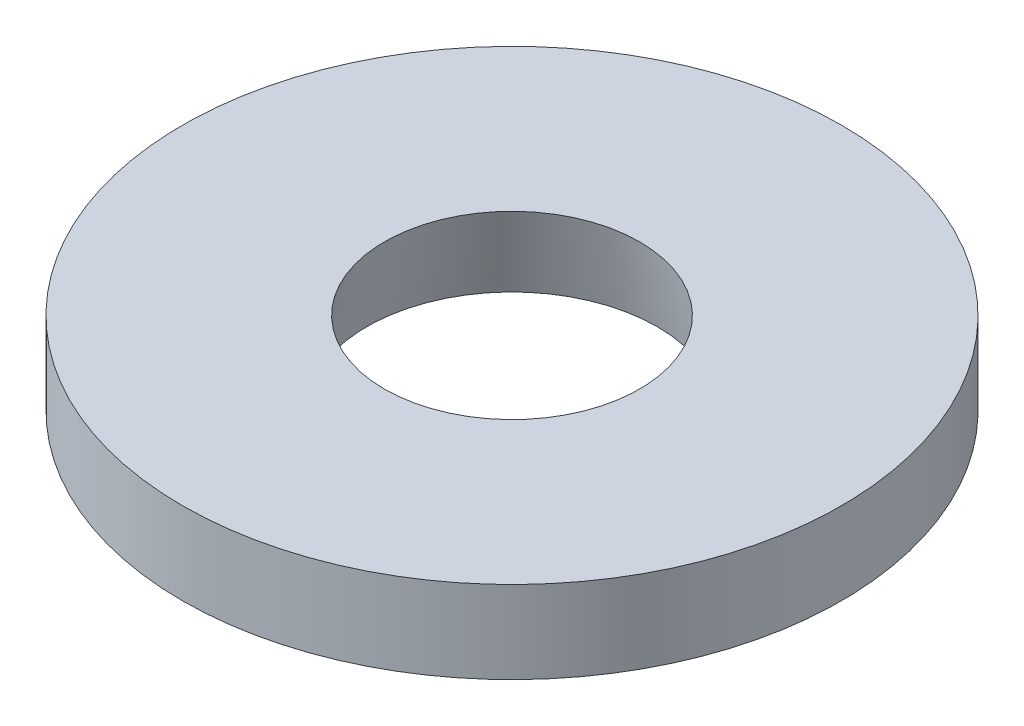
from build123d import *

# Parameters (mm, degrees)
SKETCH1_R           = 12.7
SKETCH1_R_2         = 3.556
BOSS_EXTRUDE1_DEPTH = 3.175


with BuildPart() as part:
    # Sketch1 → Boss-Extrude1 (new body)
    with BuildSketch(Plane(origin=(0, 0, 0), x_dir=(1, 0, 0), z_dir=(0, 1, 0))):
        with Locations(Location((0, 0, 0), (0, 0, 270))):
            Circle(SKETCH1_R)
        with Locations(Location((0, 0, 0), (0, 0, 270))):
            Circle(SKETCH1_R_2, mode=Mode.SUBTRACT)
    extrude(amount=BOSS_EXTRUDE1_DEPTH)

    # Sketch2 → Cut-Revolve1 (revolve, cut)
    with BuildSketch(Plane.XY, mode=Mode.PRIVATE) as cut_revolve1_sk:
        Polygon((3.556, 0), (3.556, 3.175), (3.556, 3.96875), (4.746625, 3.96875), (5.93725, -1.5875), (3.556, -1.5875), align=None)
    revolve(cut_revolve1_sk.sketch.rotate(Axis((0, 0, 0), (0, 1, 0)), 270), axis=Axis((0, 0, 0), (0, 1, 0)), mode=Mode.SUBTRACT)


solid = part.part
